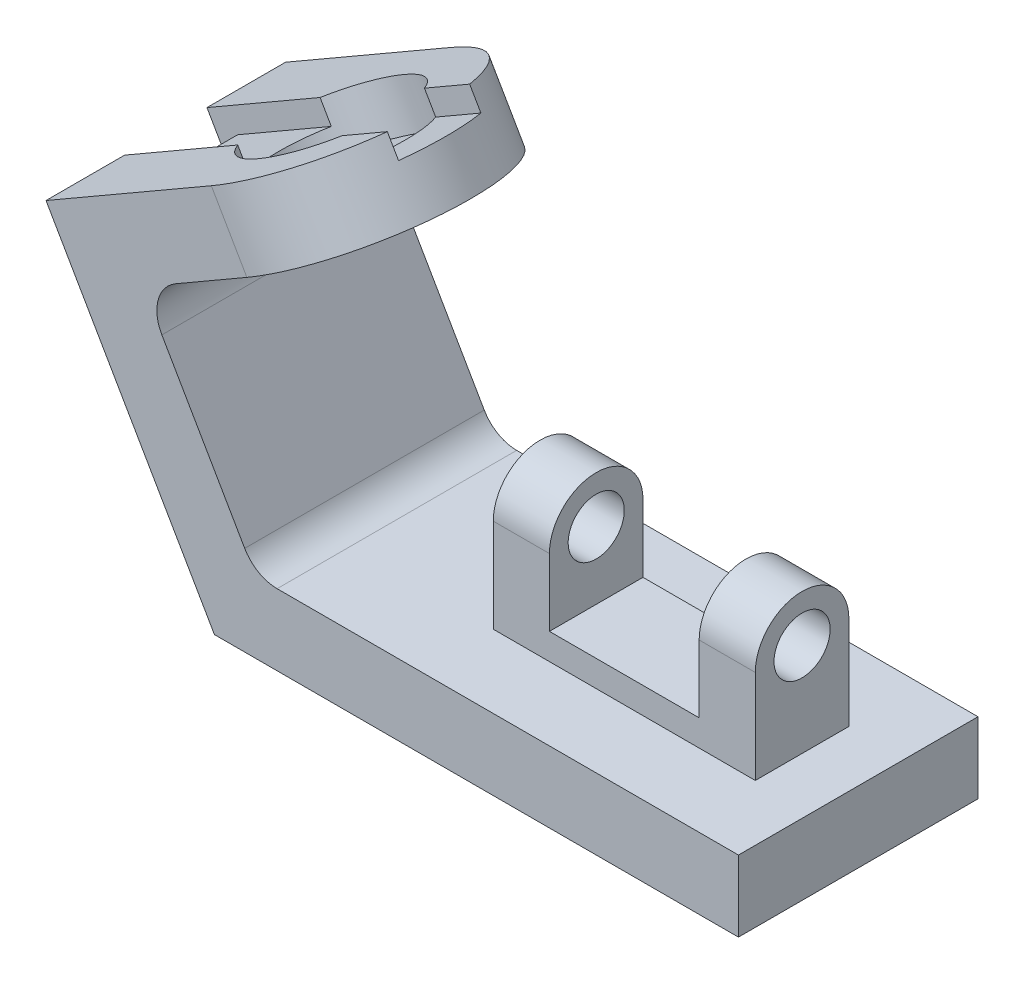
from build123d import *

# Parameters (mm, degrees)
BOSS_EXTRU_1_DEPTH      = 64
BOSS_EXTRU_2_DEPTH      = 19
ENL_V_MAT_EXTRU_1_REACH = 212.704
ESQUISSE3_R             = 9.5
ENL_V_MAT_EXTRU_2_DEPTH = 6
ESQUISSE5_R             = 19.5
ENL_V_MAT_EXTRU_3_DEPTH = 12
ESQUISSE6_W             = 22
ESQUISSE6_H             = 56
ENL_V_MAT_EXTRU_4_DEPTH = 6
BOSS_EXTRU_3_DEPTH      = 70
ESQUISSE9_W             = 40
ESQUISSE9_H             = 30.5
ENL_V_MAT_EXTRU_5_DEPTH = 189.718687482
ESQUISSE10_R            = 7.5
ENL_V_MAT_EXTRU_6_DEPTH = 168.72147449
CONG_1_R                = 10


with BuildPart() as part:
    # Esquisse1 → Boss.-Extru.1 (new body)
    with BuildSketch(Plane.XY):
        Polygon((0, 0), (-45, 77.942286341), (-0.832704407, 103.442286341), (8.667295593, 86.987803669), (-19.045517328, 70.987803669), (10.969655115, 19), (140, 19), (140, 0), align=None)
    extrude(amount=-BOSS_EXTRU_1_DEPTH)

    # Esquisse2 → Boss.-Extru.2 (add)
    with BuildSketch(Plane(origin=(-45, 77.942286341, 0), x_dir=(0.8660254037844398, 0.49999999999999806, 0), z_dir=(-0.499999999999998, 0.8660254037844397, 0))):
        with BuildLine():
            Line((51, 64), (51, 0))
            ThreePointArc((51, 0), (83, 32), (51, 64))
        make_face()
    extrude(amount=-BOSS_EXTRU_2_DEPTH)

    # Esquisse3 → Enlèv. mat.-Extru.1 (cut, up to next)
    with BuildSketch(Plane(origin=(-45, 77.942286341, 0), x_dir=(0.8660254037844398, 0.49999999999999806, 0), z_dir=(-0.499999999999998, 0.8660254037844397, 0)), mode=Mode.PRIVATE) as enl_v_mat_extru_1_sk1:
        with Locations(Location((51, 32, 0), (0, 0, 180))):
            Circle(ESQUISSE3_R)
    enl_v_mat_extru_1_tool1 = extrude(enl_v_mat_extru_1_sk1.sketch, amount=-ENL_V_MAT_EXTRU_1_REACH, mode=Mode.PRIVATE) & part.part
    add(enl_v_mat_extru_1_tool1.solids().sort_by_distance((-0.832704, 103.442286, -32))[0], mode=Mode.SUBTRACT)

    # Esquisse4 → Enlèv. mat.-Extru.2 (cut)
    with BuildSketch(Plane(origin=(-45, 77.942286341, 0), x_dir=(0.8660254037844398, 0.49999999999999806, 0), z_dir=(-0.499999999999998, 0.8660254037844397, 0))):
        with BuildLine():
            Line((0, 43), (81.049958403, 43))
            ThreePointArc((81.049958403, 43), (83, 32), (81.049958403, 21))
            Line((81.049958403, 21), (0, 21))
            Line((0, 21), (0, 43))
        make_face()
    extrude(amount=-ENL_V_MAT_EXTRU_2_DEPTH, mode=Mode.SUBTRACT)

    # Esquisse5 → Enlèv. mat.-Extru.3 (cut)
    with BuildSketch(Plane(origin=(-45, 77.942286341, 0), x_dir=(0.8660254037844398, 0.49999999999999806, 0), z_dir=(-0.499999999999998, 0.8660254037844397, 0))):
        with Locations(Location((51, 32, 0), (0, 0, 180))):
            Circle(ESQUISSE5_R)
    extrude(amount=-ENL_V_MAT_EXTRU_3_DEPTH, mode=Mode.SUBTRACT)

    # Esquisse6 → Enlèv. mat.-Extru.4 (cut)
    with BuildSketch(Plane(origin=(0, 0, 0), x_dir=(0, 0, 1), z_dir=(-0.8660254037844398, -0.49999999999999806, 0))):
        with Locations((-32, 62)):
            Rectangle(ESQUISSE6_W, ESQUISSE6_H)
    extrude(amount=-ENL_V_MAT_EXTRU_4_DEPTH, mode=Mode.SUBTRACT)

    # Esquisse8 → Boss.-Extru.3 (add)
    with BuildSketch(Plane(origin=(125, 0, 0), x_dir=(0, 0, -1), z_dir=(1, 0, 0))):
        with BuildLine():
            Line((19.5, 19), (19.5, 44))
            ThreePointArc((19.5, 44), (32, 56.5), (44.5, 44))
            Line((44.5, 44), (44.5, 19))
            Line((44.5, 19), (19.5, 19))
        make_face()
    extrude(amount=-BOSS_EXTRU_3_DEPTH)

    # Esquisse9 → Enlèv. mat.-Extru.5 (cut, through all)
    with BuildSketch(Plane.XY.offset(-19.5)):
        with Locations((90, 41.25)):
            Rectangle(ESQUISSE9_W, ESQUISSE9_H)
    extrude(amount=-ENL_V_MAT_EXTRU_5_DEPTH, mode=Mode.SUBTRACT)

    # Esquisse10 → Enlèv. mat.-Extru.6 (cut, through all)
    with BuildSketch(Plane.ZY.offset(-55)):
        with Locations((-32, 44)):
            Circle(ESQUISSE10_R)
    extrude(amount=-ENL_V_MAT_EXTRU_6_DEPTH, mode=Mode.SUBTRACT)

    # Congé1
    cong_1_edges = [part.edges().sort_by_distance(p)[0] for p in [
        (-19.045517328, 70.987803669, -32),
        (10.969655115, 19, -32),
    ]]
    fillet(cong_1_edges, radius=CONG_1_R)


solid = part.part
